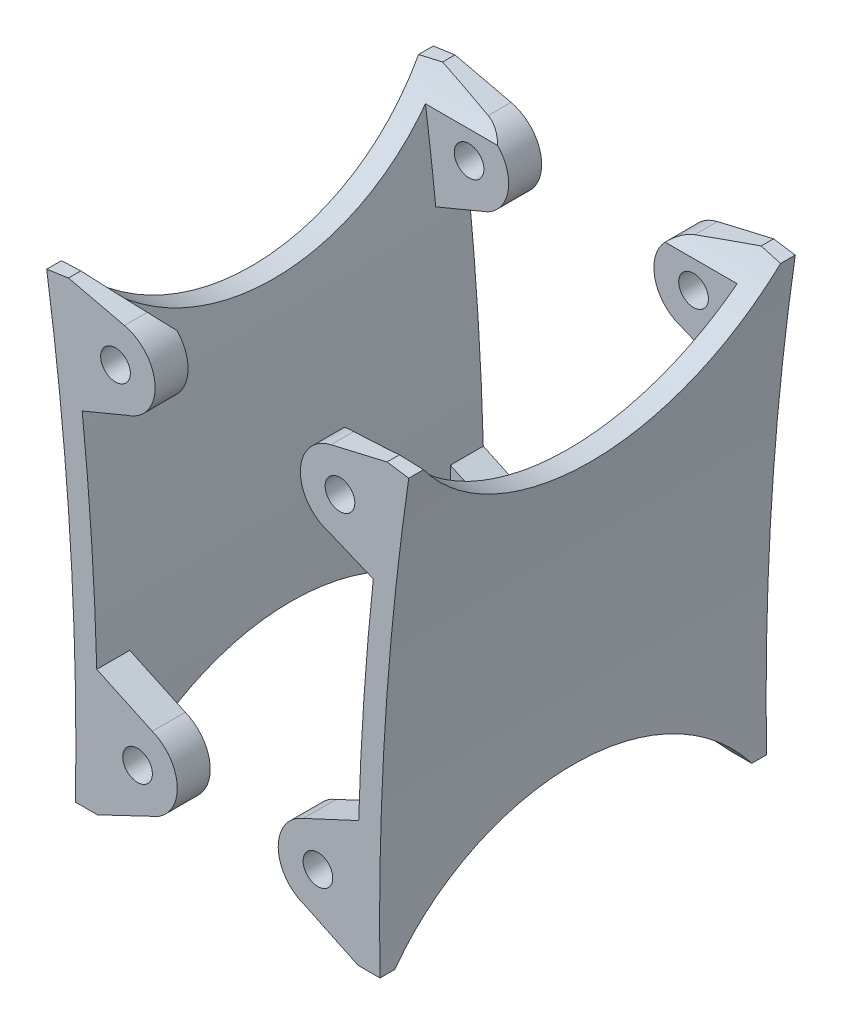
from build123d import *

# Parameters (mm, degrees)
BOSS_EXTRUDE1_DEPTH     = 70.372663867
BOSS_EXTRUDE1_2_DEPTH   = 70.372663867
SKETCH3_R               = 2.7
BOSS_EXTRUDE3_DEPTH     = 6
BOSS_EXTRUDE4_START     = 6
SKETCH4_R               = 2.7
BOSS_EXTRUDE4_DEPTH     = 6
CUT_EXTRUDE1_DEPTH      = 37
CUT_EXTRUDE1_DEPTH_BACK = 122


with BuildPart() as part:
    # Sketch1 → Boss-Extrude1 (new body)
    with BuildSketch(Plane.XY):
        with BuildLine():
            Line((52.459303301, -24.845377227), (48.501805535, -24.263819392))
            ThreePointArc((48.501805535, -24.263819392), (44.187793225, -65.159788986), (43.222187867, -106.271327968))
            Line((43.222187867, -106.271327968), (47.222792706, -106.271327968))
            ThreePointArc((47.222792706, -106.271327968), (48.177303783, -65.451357049), (52.459303301, -24.845377227))
        make_face()
    extrude(amount=BOSS_EXTRUDE1_DEPTH)



with BuildPart() as body_2:
    # Sketch1 → Boss-Extrude1 2 (new body)
    with BuildSketch(Plane.XY):
        with BuildLine():
            ThreePointArc((-9.501805535, -24.263819392), (-5.187793225, -65.159788986), (-4.222187867, -106.271327968))
            Line((-4.222187867, -106.271327968), (-8.222792706, -106.271327968))
            ThreePointArc((-8.222792706, -106.271327968), (-9.177303783, -65.451357049), (-13.459303301, -24.845377227))
            Line((-13.459303301, -24.845377227), (-9.501805535, -24.263819392))
        make_face()
    extrude(amount=BOSS_EXTRUDE1_2_DEPTH)


with BuildPart() as part_1:
    add(part.part)

    add(body_2.part)  # Boss-Extrude3 merges body 2
    # Sketch3 → Boss-Extrude3 (add)
    # profile 1 of 4: a face of its own
    with BuildSketch(Plane.XY):
        with BuildLine():
            Line((46.588315584, -44.278175656), (48.501805535, -24.263819392))
            Line((48.501805535, -24.263819392), (38.292374296, -26.649969637))
            ThreePointArc((38.292374296, -26.649969637), (32.783401233, -32.706560534), (36.477722857, -40.012932085))
            Line((36.477722857, -40.012932085), (37.87557263, -40.59481105))
            Line((37.87557263, -40.59481105), (46.000862369, -43.977102392))
            Line((46.000862369, -43.977102392), (46.588315584, -44.278175656))
        make_face()
        with Locations((39.934899894, -33.677713254)):
            Circle(SKETCH3_R, mode=Mode.SUBTRACT)
    # profile 2 of 4: a face of its own
    with BuildSketch(Plane.XY):
        with BuildLine():
            Line((43.345296139, -83.387616433), (32.872738024, -88.253947136))
            ThreePointArc((32.872738024, -88.253947136), (28.68774212, -94.787905094), (32.826525123, -101.351232952))
            Line((32.826525123, -101.351232952), (43.222187867, -106.271327968))
            Line((43.222187867, -106.271327968), (43.345296139, -83.387616433))
        make_face()
        with Locations((35.920760732, -94.813426318)):
            Circle(SKETCH3_R, mode=Mode.SUBTRACT)
    # profile 3 of 4: a face of its own
    with BuildSketch(Plane.XY):
        with BuildLine():
            ThreePointArc((6.127261979, -88.253947136), (10.312257883, -94.787905094), (6.17347488, -101.351232952))
            Line((6.17347488, -101.351232952), (-4.222187864, -106.271327968))
            Line((-4.222187864, -106.271327968), (-4.345296136, -83.387616433))
            Line((-4.345296136, -83.387616433), (6.127261979, -88.253947136))
        make_face()
        with Locations((3.079239271, -94.813426318)):
            Circle(SKETCH3_R, mode=Mode.SUBTRACT)
    # profile 4 of 4: a face of its own
    with BuildSketch(Plane.XY):
        with BuildLine():
            Line((-9.501805532, -24.263819392), (-7.588315581, -44.278175656))
            Line((-7.588315581, -44.278175656), (-7.000862366, -43.977102392))
            Line((-7.000862366, -43.977102392), (1.124427373, -40.59481105))
            Line((1.124427373, -40.59481105), (2.522277146, -40.012932085))
            ThreePointArc((2.522277146, -40.012932085), (6.21659877, -32.706560534), (0.707625707, -26.649969637))
            Line((0.707625707, -26.649969637), (-9.501805532, -24.263819392))
        make_face()
        with Locations((-0.934899891, -33.677713254)):
            Circle(SKETCH3_R, mode=Mode.SUBTRACT)
    extrude(amount=BOSS_EXTRUDE3_DEPTH)

    # Sketch4 → Boss-Extrude4 (add)
    # profile 1 of 4: a face of its own
    with BuildSketch(Plane(origin=(0, 0, 70.372663867), x_dir=(-1, 0, 0), z_dir=(0, 0, -1)).offset(BOSS_EXTRUDE4_START)):
        with BuildLine():
            ThreePointArc((-33.228418815, -88.100118301), (-28.688742082, -94.936372365), (-33.458164318, -101.614369521))
            Line((-33.458164318, -101.614369521), (-43.222187874, -106.271327968))
            Line((-43.222187874, -106.271327968), (-44.80470153, -106.271327968))
            Line((-44.80470153, -106.271327968), (-44.80470153, -83.387616563))
            Line((-44.80470153, -83.387616563), (-43.345296145, -83.387616563))
            Line((-43.345296145, -83.387616563), (-33.228418815, -88.100118301))
        make_face()
        with Locations(Location((-35.920760738, -94.813426319, 0), (0, 0, 180))):
            Circle(SKETCH4_R, mode=Mode.SUBTRACT)
    # profile 2 of 4: a face of its own
    with BuildSketch(Plane(origin=(0, 0, 70.372663867), x_dir=(-1, 0, 0), z_dir=(0, 0, -1)).offset(BOSS_EXTRUDE4_START)):
        with BuildLine():
            ThreePointArc((-38.292374303, -26.649969637), (-32.720984239, -33.462094304), (-37.875572636, -40.59481105))
            Line((-37.875572636, -40.59481105), (-46.000862375, -43.977102392))
            Line((-46.000862375, -43.977102392), (-47.765499224, -43.977102392))
            Line((-47.765499224, -43.977102392), (-49.986097494, -25.265653816))
            Line((-49.986097494, -25.265653816), (-48.501805545, -24.263819392))
            Line((-48.501805545, -24.263819392), (-38.292374303, -26.649969637))
        make_face()
        with Locations(Location((-39.9348999, -33.677713254, 0), (0, 0, 180))):
            Circle(SKETCH4_R, mode=Mode.SUBTRACT)
    # profile 3 of 4: a face of its own
    with BuildSketch(Plane(origin=(0, 0, 70.372663867), x_dir=(-1, 0, 0), z_dir=(0, 0, -1)).offset(BOSS_EXTRUDE4_START)):
        with BuildLine():
            Line((4.345296135, -83.387616563), (-5.771581195, -88.100118301))
            ThreePointArc((-5.771581195, -88.100118301), (-10.311257927, -94.936372365), (-5.541835692, -101.614369521))
            Line((-5.541835692, -101.614369521), (4.222187864, -106.271327968))
            Line((4.222187864, -106.271327968), (5.804701521, -106.271327968))
            Line((5.804701521, -106.271327968), (5.804701521, -83.387616563))
            Line((5.804701521, -83.387616563), (4.345296135, -83.387616563))
        make_face()
        with Locations(Location((-3.079239271, -94.813426319, 0), (0, 0, 180))):
            Circle(SKETCH4_R, mode=Mode.SUBTRACT)
    # profile 4 of 4: a face of its own
    with BuildSketch(Plane(origin=(0, 0, 70.372663867), x_dir=(-1, 0, 0), z_dir=(0, 0, -1)).offset(BOSS_EXTRUDE4_START)):
        with BuildLine():
            Line((9.501805535, -24.263819392), (-0.707625707, -26.649969637))
            ThreePointArc((-0.707625707, -26.649969637), (-6.27901577, -33.462094304), (-1.124427373, -40.59481105))
            Line((-1.124427373, -40.59481105), (7.000862366, -43.977102392))
            Line((7.000862366, -43.977102392), (8.765499214, -43.977102392))
            Line((8.765499214, -43.977102392), (10.986097485, -25.265653816))
            Line((10.986097485, -25.265653816), (9.501805535, -24.263819392))
        make_face()
        with Locations(Location((0.934899891, -33.677713254, 0), (0, 0, 180))):
            Circle(SKETCH4_R, mode=Mode.SUBTRACT)
    extrude(amount=-BOSS_EXTRUDE4_DEPTH)

    # Sketch5 → Cut-Extrude1 (cut, two sides: drawn at the far end of the back side and taken through both)
    with BuildSketch(Plane(origin=(42, 0, 0), x_dir=(0, 0, -1), z_dir=(1, 0, 0)).offset(-CUT_EXTRUDE1_DEPTH_BACK)):
        with BuildLine():
            ThreePointArc((-67.683528548, -24.845377226), (-35.186331933, -40.906729976), (-2.689135319, -24.845377226))
            Line((-2.689135319, -24.845377226), (-35.186331933, -24.845377226))
            Line((-35.186331933, -24.845377226), (-67.683528548, -24.845377226))
        make_face()
        with BuildLine():
            ThreePointArc((-2.689135319, -24.845377226), (-1.868150155, -23.733084929), (-1.085218994, -22.593686145))
            Line((-1.085218994, -22.593686145), (-35.186331933, -22.593686145))
            Line((-35.186331933, -22.593686145), (-35.186331933, -24.845377226))
            Line((-35.186331933, -24.845377226), (-2.689135319, -24.845377226))
        make_face()
        with BuildLine():
            Line((-35.186331933, -24.845377226), (-35.186331933, -22.593686145))
            Line((-35.186331933, -22.593686145), (-69.287444872, -22.593686145))
            ThreePointArc((-69.287444872, -22.593686145), (-68.504513712, -23.733084929), (-67.683528548, -24.845377226))
            Line((-67.683528548, -24.845377226), (-35.186331933, -24.845377226))
        make_face()
        with BuildLine():
            Line((-35.186331933, -106.271327969), (-2.689135319, -106.271327969))
            ThreePointArc((-2.689135319, -106.271327969), (-35.186331933, -90.20997522), (-67.683528548, -106.271327969))
            Line((-67.683528548, -106.271327969), (-35.186331933, -106.271327969))
        make_face()
        with BuildLine():
            ThreePointArc((-1.085218994, -108.52301905), (-1.868150155, -107.383620266), (-2.689135319, -106.271327969))
            Line((-2.689135319, -106.271327969), (-35.186331933, -106.271327969))
            Line((-35.186331933, -106.271327969), (-35.186331933, -108.52301905))
            Line((-35.186331933, -108.52301905), (-1.085218994, -108.52301905))
        make_face()
        with BuildLine():
            Line((-35.186331933, -108.52301905), (-35.186331933, -106.271327969))
            Line((-35.186331933, -106.271327969), (-67.683528548, -106.271327969))
            ThreePointArc((-67.683528548, -106.271327969), (-68.504513712, -107.383620266), (-69.287444872, -108.52301905))
            Line((-69.287444872, -108.52301905), (-35.186331933, -108.52301905))
        make_face()
    extrude(amount=CUT_EXTRUDE1_DEPTH + CUT_EXTRUDE1_DEPTH_BACK, mode=Mode.SUBTRACT)


solid = part_1.part
